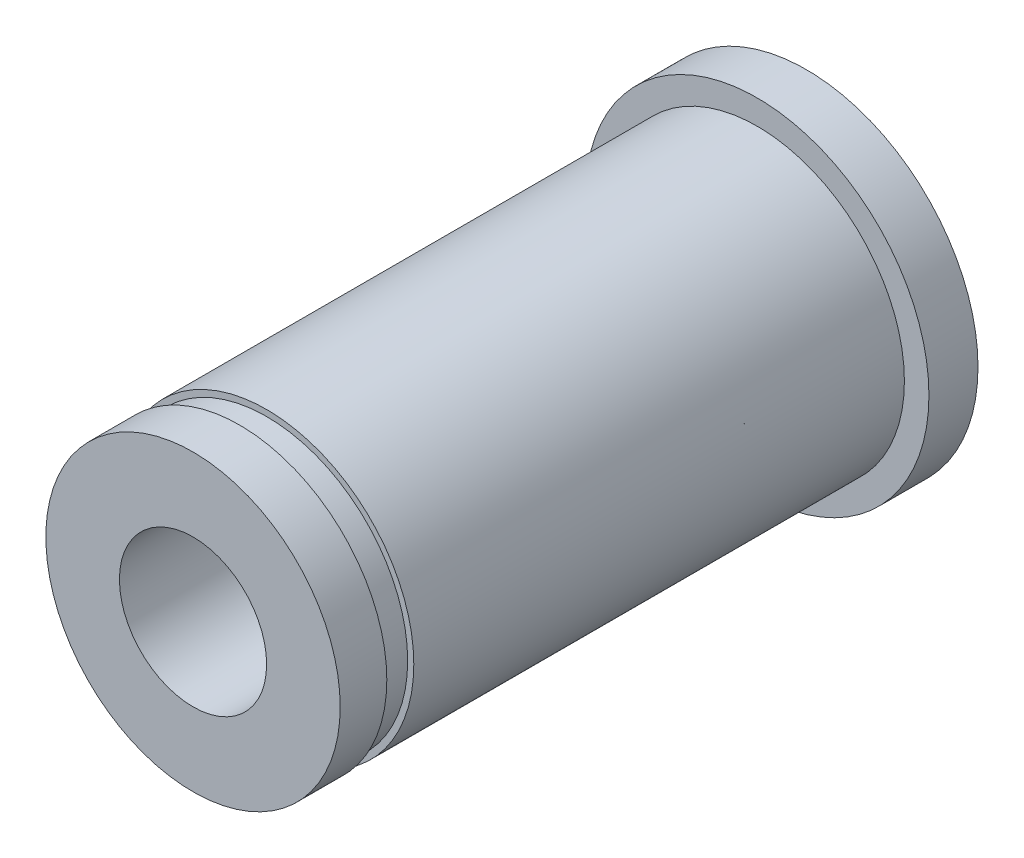
from build123d import *

# Parameters (mm, degrees)
SKETCH_1_R          = 6
EXTRUDE_1_DEPTH     = 23
SKETCH_2_R          = 7
EXTRUDE_2_DEPTH     = 2
SKETCH_3_W          = 0.25
SKETCH_3_H          = 1.1
SKETCH_4_R          = 3
CUT_EXTRUDE_1_DEPTH = 27


with BuildPart() as part:
    # 草图1 → 凸台-拉伸1 (new body)
    with BuildSketch(Plane.XY):
        Circle(SKETCH_1_R)
    extrude(amount=EXTRUDE_1_DEPTH)

    # 草图2 → 凸台-拉伸2 (add)
    with BuildSketch(Plane(origin=(0, 0, 0), x_dir=(-1, 0, 0), z_dir=(0, 0, -1))):
        Circle(SKETCH_2_R)
    extrude(amount=EXTRUDE_2_DEPTH)

    # 草图3 → 切除-旋转1 (revolve, cut)
    with BuildSketch(Plane(origin=(0, 0, 0), x_dir=(1, 0, 0), z_dir=(0, 1, 0)), mode=Mode.PRIVATE) as cut_revolve_1_sk:
        with Locations((-5.875, -20.55)):
            Rectangle(SKETCH_3_W, SKETCH_3_H)
    revolve(cut_revolve_1_sk.sketch.rotate(Axis((0, 0, 23), (0, 0, -1)), 180), axis=Axis((0, 0, 23), (0, 0, -1)), mode=Mode.SUBTRACT)

    # 草图4 → 切除-拉伸1 (cut)
    with BuildSketch(Plane(origin=(0, 0, -2), x_dir=(-1, 0, 0), z_dir=(0, 0, -1))):
        Circle(SKETCH_4_R)
    extrude(amount=-CUT_EXTRUDE_1_DEPTH, mode=Mode.SUBTRACT)


solid = part.part
